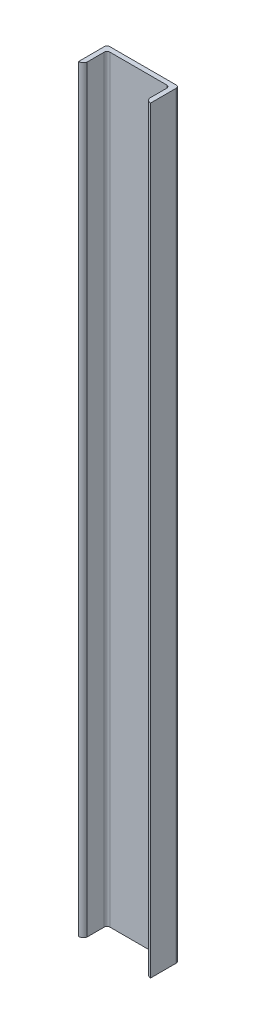
from build123d import *

# Parameters (mm, degrees)
BOSS_EXTRUDE1_DEPTH = 800
FILLET1_R           = 3


with BuildPart() as part:
    # Sketch2 → Boss-Extrude1 (new body)
    with BuildSketch(Plane(origin=(0, 0, 0), x_dir=(1, 0, 0), z_dir=(0, 1, 0))):
        with BuildLine():
            Line((38, 12.187104498), (38, -17.812895502))
            ThreePointArc((38, -17.812895502), (34.80462792, -16.696369068), (33, -13.832743381))
            Line((33, -13.832743381), (33, 7.187104498))
            Line((33, 7.187104498), (-33, 7.187104498))
            Line((-33, 7.187104498), (-33, -13.832743381))
            ThreePointArc((-33, -13.832743381), (-34.80462792, -16.696369068), (-38, -17.812895502))
            Line((-38, -17.812895502), (-38, 12.187104498))
            Line((-38, 12.187104498), (38, 12.187104498))
        make_face()
    extrude(amount=BOSS_EXTRUDE1_DEPTH)

    # Fillet1
    fillet1_edges = [part.edges().sort_by_distance(p)[0] for p in [
        (38, 400, -12.187104498),
        (33, 400, -7.187104498),
        (-33, 400, -7.187104498),
        (-38, 400, -12.187104498),
    ]]
    fillet(fillet1_edges, radius=FILLET1_R)


solid = part.part
